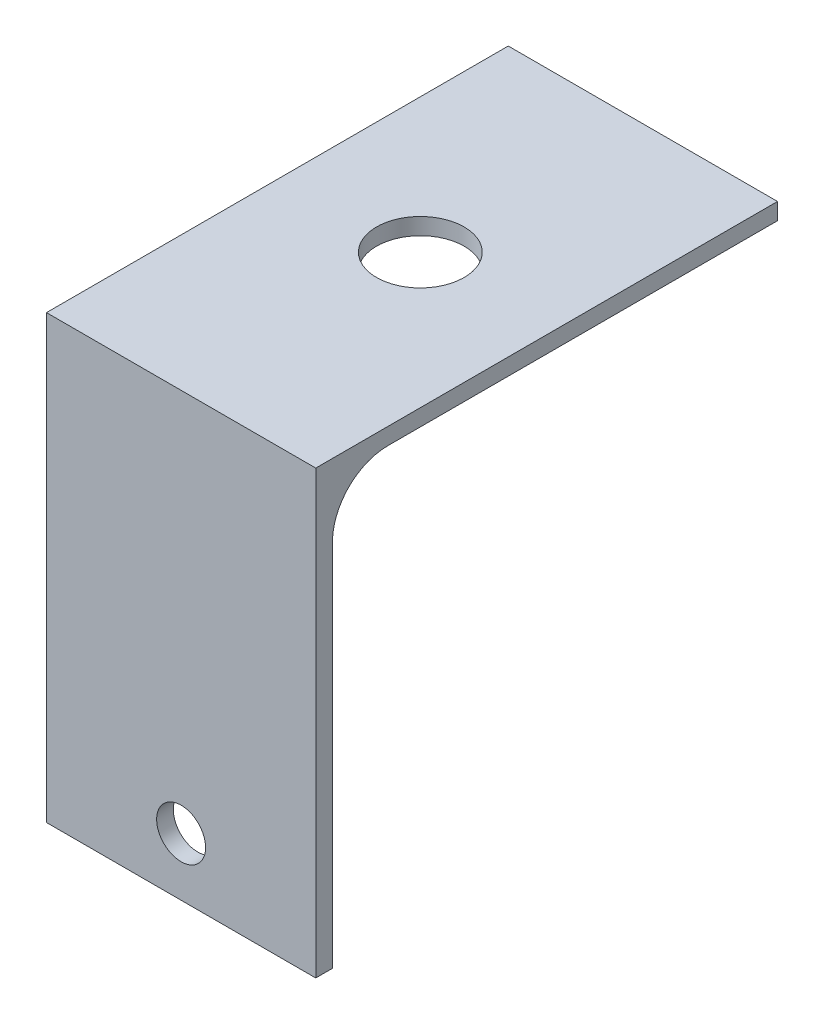
from build123d import *

# Parameters (mm, degrees)
SKETCH1_W           = 24.2
SKETCH1_H           = 39.69
BOSS_EXTRUDE1_DEPTH = 1.5
SKETCH2_R           = 2.2
CUT_EXTRUDE1_DEPTH  = 24.291286461
SKETCH4_W           = 24.2
SKETCH4_H           = 40
BOSS_EXTRUDE2_DEPTH = 1.5
SKETCH5_R           = 3.937
CUT_EXTRUDE2_DEPTH  = 57.611713452
FILLET1_R           = 5


with BuildPart() as part:
    # Sketch1 → Boss-Extrude1 (new body)
    with BuildSketch(Plane.XY):
        Rectangle(SKETCH1_W, SKETCH1_H)
    extrude(amount=BOSS_EXTRUDE1_DEPTH)

    # Sketch2 → Cut-Extrude1 (cut, through all)
    with BuildSketch(Plane.XY.offset(1.5)):
        with Locations((0, -14.645)):
            Circle(SKETCH2_R)
    extrude(amount=-CUT_EXTRUDE1_DEPTH, mode=Mode.SUBTRACT)

    # Sketch4 → Boss-Extrude2 (add)
    with BuildSketch(Plane(origin=(0, 19.845, 0), x_dir=(1, 0, 0), z_dir=(0, 1, 0))):
        with Locations((0, 20)):
            Rectangle(SKETCH4_W, SKETCH4_H)
    extrude(amount=-BOSS_EXTRUDE2_DEPTH)

    # Sketch5 → Cut-Extrude2 (cut, through all)
    with BuildSketch(Plane.XZ.offset(-18.345)):
        with Locations(Location((0, -20, 0), (0, 0, 270))):
            Circle(SKETCH5_R)
    extrude(amount=-CUT_EXTRUDE2_DEPTH, mode=Mode.SUBTRACT)

    # Fillet1
    fillet1_edges = [part.edges().sort_by_distance(p)[0] for p in [
        (0, 18.345, 0),
    ]]
    fillet(fillet1_edges, radius=FILLET1_R)


solid = part.part
